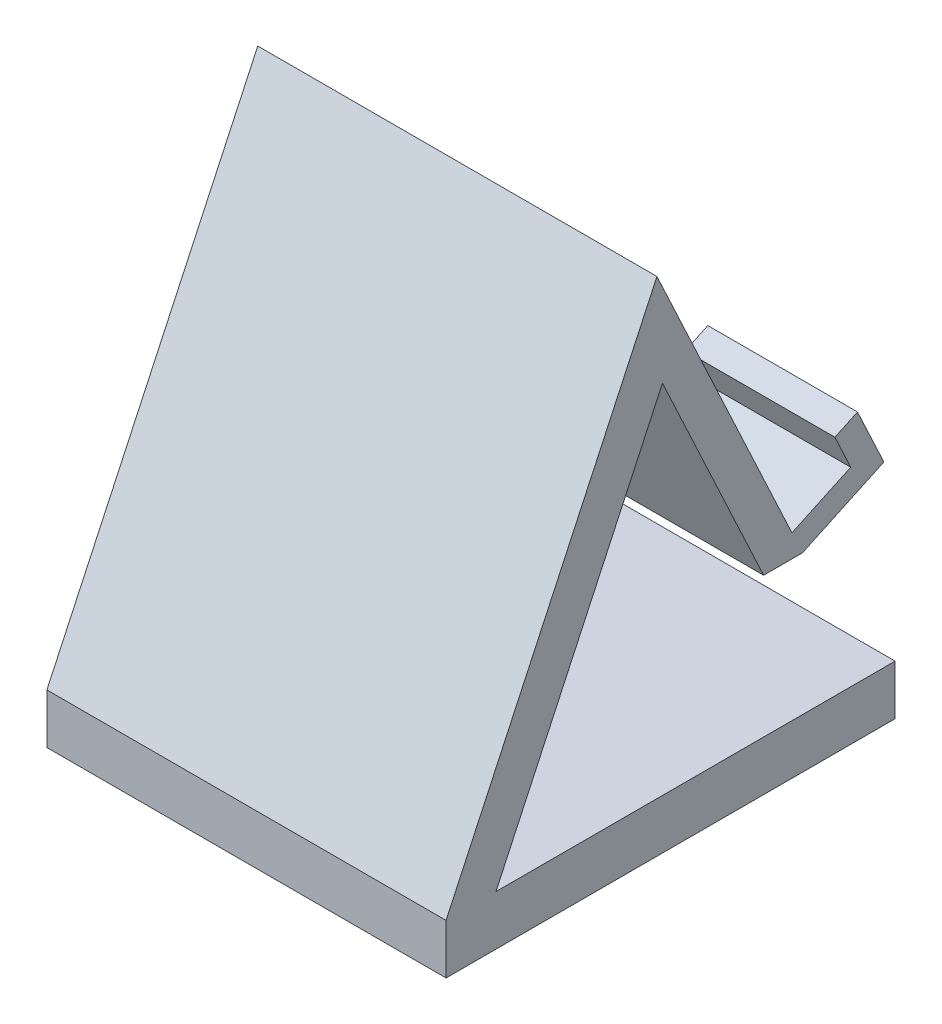
from build123d import *

# Parameters (mm, degrees)
BOSS_EXTRUDE1_DEPTH = 80
SKETCH2_W           = 30
SKETCH2_H           = 5
BOSS_EXTRUDE2_DEPTH = 13
SKETCH3_W           = 30
SKETCH3_H           = 12.5
BOSS_EXTRUDE3_DEPTH = 5


with BuildPart() as part:
    # Sketch1 → Boss-Extrude1 (new body)
    with BuildSketch(Plane(origin=(0, 0, 0), x_dir=(0, 0, -1), z_dir=(1, 0, 0))):
        Polygon((0, 10), (42.261826174, 100.630778704), (46.074889763, 92.453637449), (71.431985467, 38.075170227), (63.645988922, 38.075170227), (43.368827902, 81.559682364), (10, 10), (90, 10), (90, 0), (0, 0), align=None)
    extrude(amount=BOSS_EXTRUDE1_DEPTH)

    # Sketch2 → Boss-Extrude2 (add)
    with BuildSketch(Plane(origin=(0, 34.160499048, -73.257426617), x_dir=(-1, 0, 0), z_dir=(0, 0.4226182617406983, -0.9063077870366506))):
        with Locations((-65, 6.819361739)):
            Rectangle(SKETCH2_W, SKETCH2_H)
        with Locations((-15, 6.819361739)):
            Rectangle(SKETCH2_W, SKETCH2_H)
    extrude(amount=BOSS_EXTRUDE2_DEPTH)

    # Sketch3 → Boss-Extrude3 (add)
    with BuildSketch(Plane(origin=(0, 39.654536451, -85.039427849), x_dir=(-1, 0, 0), z_dir=(0, 0.4226182617406977, -0.9063077870366508))):
        with Locations((-65, 10.569361739)):
            Rectangle(SKETCH3_W, SKETCH3_H)
        with Locations((-15, 10.569361739)):
            Rectangle(SKETCH3_W, SKETCH3_H)
    extrude(amount=BOSS_EXTRUDE3_DEPTH)


solid = part.part
